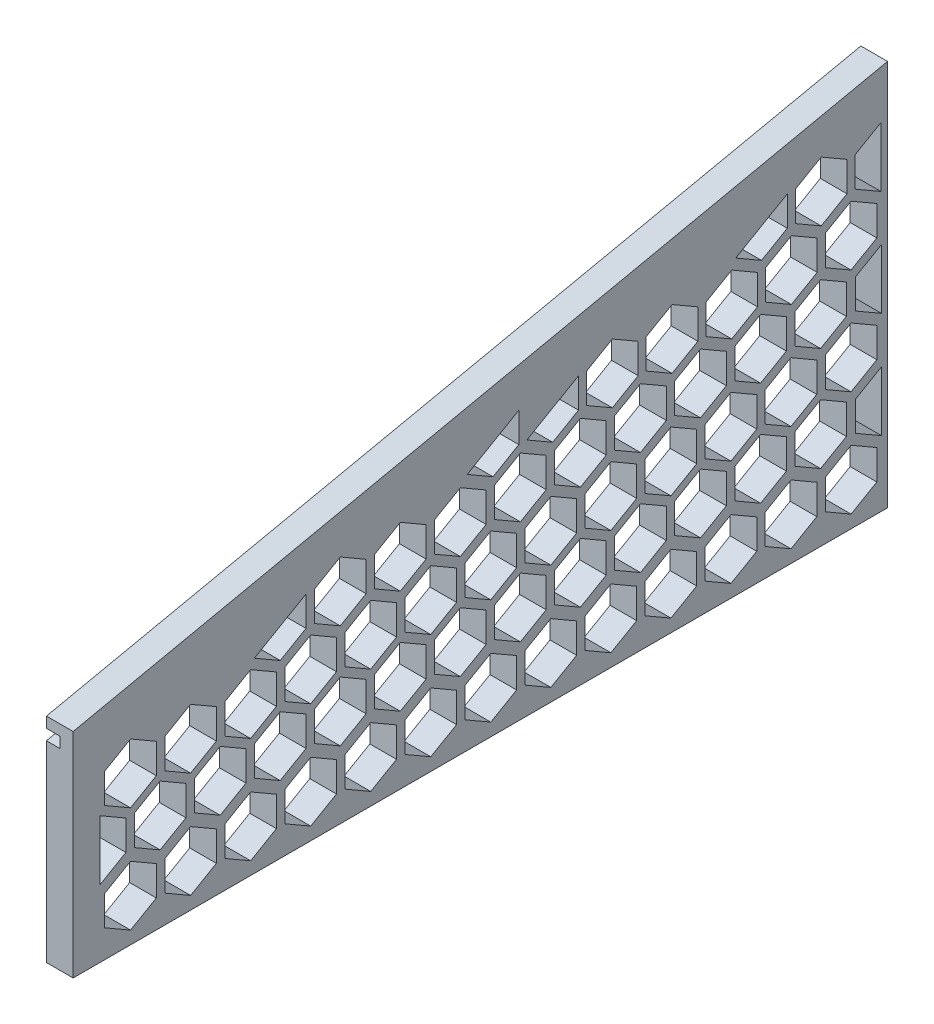
from build123d import *

# Parameters (mm, degrees)
BOSS_EXTRUDE1_DEPTH = 5
CUT_EXTRUDE1_DEPTH  = 10
SKETCH4_W           = 152.591025714
SKETCH4_H           = 40
BOSS_EXTRUDE3_DEPTH = 5
CUT_EXTRUDE3_DEPTH  = 5
CUT_EXTRUDE4_DEPTH  = 2.5


with BuildPart() as part:
    # Sketch1 → Boss-Extrude1 (new body)
    with BuildSketch(Plane(origin=(0, 0, 0), x_dir=(0, 0, -1), z_dir=(1, 0, 0))):
        Polygon((152.591025714, 32.434223768), (0, 0), (152.591025714, 0), align=None)
    extrude(amount=BOSS_EXTRUDE1_DEPTH)

    # Sketch2 → Cut-Extrude1 (cut)
    with BuildSketch(Plane(origin=(5, 0, 0), x_dir=(0, 0, -1), z_dir=(1, 0, 0))):
        Polygon((151.341025714, 11.955858852), (151.341025714, 23.12302347), (146.505501591, 20.331232316), (146.505501591, 14.747650007), align=None)
        Polygon((73.839977467, 4.791791155), (83.511025714, 10.375373464), (83.511025714, 4.791791155), (78.675501591, 2), align=None)
        Polygon((133.816549838, 20.331232316), (124.145501591, 14.747650007), (128.981025714, 11.955858852), (133.816549838, 14.747650007), align=None)
        Polygon((94.691025714, 10.375373464), (85.019977467, 4.791791155), (89.855501591, 2), (94.691025714, 4.791791155), align=None)
        Polygon((145.755501591, 13.167164618), (140.919977467, 10.375373464), (140.919977467, 4.791791155), (145.755501591, 2), (150.591025714, 4.791791155), (150.591025714, 10.375373464), align=None)
        Polygon((134.575501591, 13.167164618), (129.739977467, 10.375373464), (129.739977467, 4.791791155), (134.575501591, 2), (139.411025714, 4.791791155), (139.411025714, 10.375373464), align=None)
        Polygon((140.161025714, 11.955858852), (135.325501591, 14.747650007), (135.325501591, 20.331232316), (140.161025714, 23.12302347), (144.996549838, 20.331232316), (144.996549838, 14.747650007), align=None)
        Polygon((123.395501591, 13.167164618), (118.559977467, 10.375373464), (118.559977467, 4.791791155), (123.395501591, 2), (128.231025714, 4.791791155), (128.231025714, 10.375373464), align=None)
        Polygon((112.215501591, 13.167164618), (107.379977467, 10.375373464), (107.379977467, 4.791791155), (112.215501591, 2), (117.051025714, 4.791791155), (117.051025714, 10.375373464), align=None)
        Polygon((101.035501591, 13.167164618), (96.199977467, 10.375373464), (96.199977467, 4.791791155), (101.035501591, 2), (105.871025714, 4.791791155), (105.871025714, 10.375373464), align=None)
    extrude(amount=-CUT_EXTRUDE1_DEPTH, mode=Mode.SUBTRACT)

    # Sketch4 → Boss-Extrude3 (add)
    with BuildSketch(Plane.ZY):
        with Locations((-76.295512857, -20)):
            Rectangle(SKETCH4_W, SKETCH4_H)
    extrude(amount=-BOSS_EXTRUDE3_DEPTH)

    # Sketch6 → Cut-Extrude3 (cut)
    with BuildSketch(Plane(origin=(5, 0, 0), x_dir=(0, 0, -1), z_dir=(1, 0, 0))):
        Polygon((140.049977467, -16.195093048), (144.885501591, -18.986884203), (144.885501591, -24.570466512), (140.049977467, -27.362257666), (135.214453343, -24.570466512), (135.214453343, -18.986884203), align=None)
        Polygon((145.755501591, -6.597350714), (150.591025714, -9.389141869), (150.591025714, -14.972724178), (145.755501591, -17.764515332), (140.919977467, -14.972724178), (140.919977467, -9.389141869), align=None)
        Polygon((150.591025714, 4.791791155), (150.591025714, 10.375373464), (145.755501591, 13.167164618), (140.919977467, 10.375373464), (140.919977467, 4.791791155), (145.755501591, 2), align=None)
        Polygon((140.049977467, 3.284906952), (144.885501591, 0.493115797), (144.885501591, -5.090466512), (140.049977467, -7.882257666), (135.214453343, -5.090466512), (135.214453343, 0.493115797), align=None)
        Polygon((146.625501591, -5.090466512), (151.461025714, -7.882257666), (151.461025714, 3.284906952), (146.625501591, 0.493115797), align=None)
        Polygon((145.755501591, -26.437350714), (150.591025714, -29.229141869), (150.591025714, -34.812724178), (145.755501591, -37.604515332), (140.919977467, -34.812724178), (140.919977467, -29.229141869), align=None)
        Polygon((134.505501591, -26.437350714), (139.341025714, -29.229141869), (139.341025714, -34.812724178), (134.505501591, -37.604515332), (129.669977467, -34.812724178), (129.669977467, -29.229141869), align=None)
        Polygon((128.799977467, -16.195093048), (133.635501591, -18.986884203), (133.635501591, -24.570466512), (128.799977467, -27.362257666), (123.964453343, -24.570466512), (123.964453343, -18.986884203), align=None)
        Polygon((134.505501591, -6.597350714), (139.341025714, -9.389141869), (139.341025714, -14.972724178), (134.505501591, -17.764515332), (129.669977467, -14.972724178), (129.669977467, -9.389141869), align=None)
        Polygon((128.799977467, 3.284906952), (133.635501591, 0.493115797), (133.635501591, -5.090466512), (128.799977467, -7.882257666), (123.964453343, -5.090466512), (123.964453343, 0.493115797), align=None)
        Polygon((123.255501591, -26.437350714), (128.091025714, -29.229141869), (128.091025714, -34.812724178), (123.255501591, -37.604515332), (118.419977467, -34.812724178), (118.419977467, -29.229141869), align=None)
        Polygon((117.549977467, -16.195093048), (122.385501591, -18.986884203), (122.385501591, -24.570466512), (117.549977467, -27.362257666), (112.714453343, -24.570466512), (112.714453343, -18.986884203), align=None)
        Polygon((123.255501591, -6.597350714), (128.091025714, -9.389141869), (128.091025714, -14.972724178), (123.255501591, -17.764515332), (118.419977467, -14.972724178), (118.419977467, -9.389141869), align=None)
        Polygon((117.549977467, 3.284906952), (122.385501591, 0.493115797), (122.385501591, -5.090466512), (117.549977467, -7.882257666), (112.714453343, -5.090466512), (112.714453343, 0.493115797), align=None)
        Polygon((112.005501591, -26.437350714), (116.841025714, -29.229141869), (116.841025714, -34.812724178), (112.005501591, -37.604515332), (107.169977467, -34.812724178), (107.169977467, -29.229141869), align=None)
        Polygon((106.299977467, -16.195093048), (111.135501591, -18.986884203), (111.135501591, -24.570466512), (106.299977467, -27.362257666), (101.464453343, -24.570466512), (101.464453343, -18.986884203), align=None)
        Polygon((112.005501591, -6.597350714), (116.841025714, -9.389141869), (116.841025714, -14.972724178), (112.005501591, -17.764515332), (107.169977467, -14.972724178), (107.169977467, -9.389141869), align=None)
        Polygon((106.299977467, 3.284906952), (111.135501591, 0.493115797), (111.135501591, -5.090466512), (106.299977467, -7.882257666), (101.464453343, -5.090466512), (101.464453343, 0.493115797), align=None)
        Polygon((100.755501591, -26.437350714), (105.591025714, -29.229141869), (105.591025714, -34.812724178), (100.755501591, -37.604515332), (95.919977467, -34.812724178), (95.919977467, -29.229141869), align=None)
        Polygon((95.049977467, -16.195093048), (99.885501591, -18.986884203), (99.885501591, -24.570466512), (95.049977467, -27.362257666), (90.214453343, -24.570466512), (90.214453343, -18.986884203), align=None)
        Polygon((100.755501591, -6.597350714), (105.591025714, -9.389141869), (105.591025714, -14.972724178), (100.755501591, -17.764515332), (95.919977467, -14.972724178), (95.919977467, -9.389141869), align=None)
        Polygon((95.049977467, 3.284906952), (99.885501591, 0.493115797), (99.885501591, -5.090466512), (95.049977467, -7.882257666), (90.214453343, -5.090466512), (90.214453343, 0.493115797), align=None)
        Polygon((89.505501591, -26.437350714), (94.341025714, -29.229141869), (94.341025714, -34.812724178), (89.505501591, -37.604515332), (84.669977467, -34.812724178), (84.669977467, -29.229141869), align=None)
        Polygon((83.799977467, -16.195093048), (88.635501591, -18.986884203), (88.635501591, -24.570466512), (83.799977467, -27.362257666), (78.964453343, -24.570466512), (78.964453343, -18.986884203), align=None)
        Polygon((89.505501591, -6.597350714), (94.341025714, -9.389141869), (94.341025714, -14.972724178), (89.505501591, -17.764515332), (84.669977467, -14.972724178), (84.669977467, -9.389141869), align=None)
        Polygon((83.799977467, 3.284906952), (88.635501591, 0.493115797), (88.635501591, -5.090466512), (83.799977467, -7.882257666), (78.964453343, -5.090466512), (78.964453343, 0.493115797), align=None)
        Polygon((78.255501591, -26.437350714), (83.091025714, -29.229141869), (83.091025714, -34.812724178), (78.255501591, -37.604515332), (73.419977467, -34.812724178), (73.419977467, -29.229141869), align=None)
        Polygon((72.549977467, -16.195093048), (77.385501591, -18.986884203), (77.385501591, -24.570466512), (72.549977467, -27.362257666), (67.714453343, -24.570466512), (67.714453343, -18.986884203), align=None)
        Polygon((78.255501591, -6.597350714), (83.091025714, -9.389141869), (83.091025714, -14.972724178), (78.255501591, -17.764515332), (73.419977467, -14.972724178), (73.419977467, -9.389141869), align=None)
        Polygon((72.549977467, 3.284906952), (77.385501591, 0.493115797), (77.385501591, -5.090466512), (72.549977467, -7.882257666), (67.714453343, -5.090466512), (67.714453343, 0.493115797), align=None)
        Polygon((67.005501591, -26.437350714), (71.841025714, -29.229141869), (71.841025714, -34.812724178), (67.005501591, -37.604515332), (62.169977467, -34.812724178), (62.169977467, -29.229141869), align=None)
        Polygon((61.299977467, -16.195093048), (66.135501591, -18.986884203), (66.135501591, -24.570466512), (61.299977467, -27.362257666), (56.464453343, -24.570466512), (56.464453343, -18.986884203), align=None)
        Polygon((67.005501591, -6.597350714), (71.841025714, -9.389141869), (71.841025714, -14.972724178), (67.005501591, -17.764515332), (62.169977467, -14.972724178), (62.169977467, -9.389141869), align=None)
        Polygon((61.299977467, 3.284906952), (66.135501591, 0.493115797), (66.135501591, -5.090466512), (61.299977467, -7.882257666), (56.464453343, -5.090466512), (56.464453343, 0.493115797), align=None)
        Polygon((55.755501591, -26.437350714), (60.591025714, -29.229141869), (60.591025714, -34.812724178), (55.755501591, -37.604515332), (50.919977467, -34.812724178), (50.919977467, -29.229141869), align=None)
        Polygon((50.049977467, -16.195093048), (54.885501591, -18.986884203), (54.885501591, -24.570466512), (50.049977467, -27.362257666), (45.214453343, -24.570466512), (45.214453343, -18.986884203), align=None)
        Polygon((55.755501591, -6.597350714), (60.591025714, -9.389141869), (60.591025714, -14.972724178), (55.755501591, -17.764515332), (50.919977467, -14.972724178), (50.919977467, -9.389141869), align=None)
        Polygon((50.049977467, 3.284906952), (54.885501591, 0.493115797), (54.885501591, -5.090466512), (50.049977467, -7.882257666), (45.214453343, -5.090466512), (45.214453343, 0.493115797), align=None)
        Polygon((44.505501591, -26.437350714), (49.341025714, -29.229141869), (49.341025714, -34.812724178), (44.505501591, -37.604515332), (39.669977467, -34.812724178), (39.669977467, -29.229141869), align=None)
        Polygon((38.799977467, -16.195093048), (43.635501591, -18.986884203), (43.635501591, -24.570466512), (38.799977467, -27.362257666), (33.964453343, -24.570466512), (33.964453343, -18.986884203), align=None)
        Polygon((44.505501591, -6.597350714), (49.341025714, -9.389141869), (49.341025714, -14.972724178), (44.505501591, -17.764515332), (39.669977467, -14.972724178), (39.669977467, -9.389141869), align=None)
        Polygon((43.635501591, 0.493115797), (43.635501591, -5.090466512), (38.799977467, -7.882257666), (33.964453343, -5.090466512), align=None)
        Polygon((33.255501591, -26.437350714), (38.091025714, -29.229141869), (38.091025714, -34.812724178), (33.255501591, -37.604515332), (28.419977467, -34.812724178), (28.419977467, -29.229141869), align=None)
        Polygon((27.549977467, -16.195093048), (32.385501591, -18.986884203), (32.385501591, -24.570466512), (27.549977467, -27.362257666), (22.714453343, -24.570466512), (22.714453343, -18.986884203), align=None)
        Polygon((33.255501591, -6.597350714), (38.091025714, -9.389141869), (38.091025714, -14.972724178), (33.255501591, -17.764515332), (28.419977467, -14.972724178), (28.419977467, -9.389141869), align=None)
        Polygon((22.005501591, -26.437350714), (26.841025714, -29.229141869), (26.841025714, -34.812724178), (22.005501591, -37.604515332), (17.169977467, -34.812724178), (17.169977467, -29.229141869), align=None)
        Polygon((16.299977467, -16.195093048), (21.135501591, -18.986884203), (21.135501591, -24.570466512), (16.299977467, -27.362257666), (11.464453343, -24.570466512), (11.464453343, -18.986884203), align=None)
        Polygon((22.005501591, -6.597350714), (26.841025714, -9.389141869), (26.841025714, -14.972724178), (22.005501591, -17.764515332), (17.169977467, -14.972724178), (17.169977467, -9.389141869), align=None)
        Polygon((10.755501591, -26.437350714), (15.591025714, -29.229141869), (15.591025714, -34.812724178), (10.755501591, -37.604515332), (5.919977467, -34.812724178), (5.919977467, -29.229141869), align=None)
        Polygon((5.049977467, -16.195093048), (9.885501591, -18.986884203), (9.885501591, -24.570466512), (5.049977467, -27.362257666), align=None)
        Polygon((10.755501591, -6.597350714), (15.591025714, -9.389141869), (15.591025714, -14.972724178), (10.755501591, -17.764515332), (5.919977467, -14.972724178), (5.919977467, -9.389141869), align=None)
        Polygon((151.461025714, -16.555093048), (146.625501591, -19.346884203), (146.625501591, -24.930466512), (151.461025714, -27.722257666), align=None)
    extrude(amount=-CUT_EXTRUDE3_DEPTH, mode=Mode.SUBTRACT)

    # Sketch8 → Cut-Extrude4 (cut)
    with BuildSketch(Plane(origin=(0, 0, 0), x_dir=(0, 0, -1), z_dir=(1, 0, 0))):
        Polygon((0, -2), (152.591025714, 30.434223768), (152.591025714, 28.434223768), (0, -4), align=None)
    extrude(amount=CUT_EXTRUDE4_DEPTH, mode=Mode.SUBTRACT)


solid = part.part
